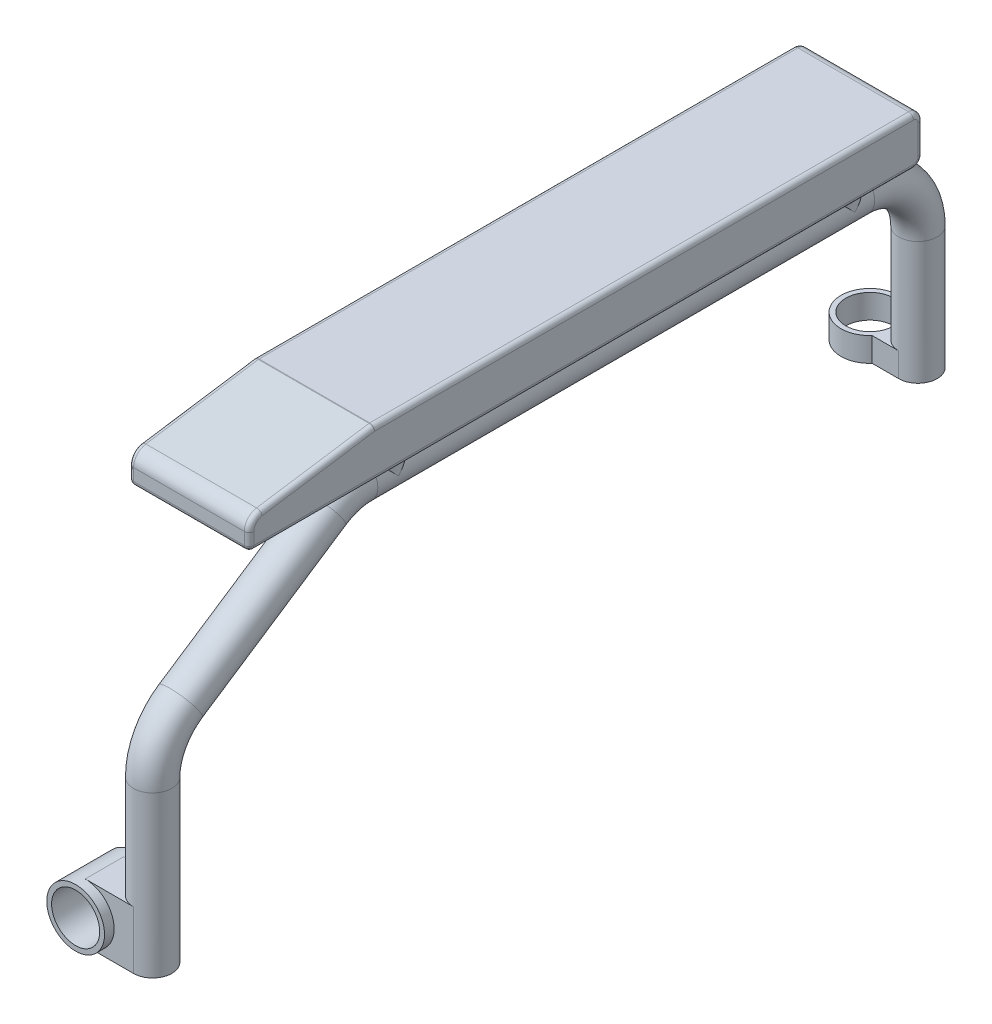
from build123d import *

# Parameters (mm, degrees)
SKETCH2_R                = 10.16
BOSS_EXTRUDE1_DEPTH      = 15.24
BOSS_EXTRUDE1_DEPTH_BACK = 15.24
SKETCH4_R                = 15.24
SKETCH5_R                = 10.16
BOSS_EXTRUDE2_DEPTH      = 15.24
SKETCH6_W                = 20.32
SKETCH6_H                = 30.48
BOSS_EXTRUDE3_DEPTH      = 25.4
SKETCH7_R                = 12.7
CUT_EXTRUDE1_DEPTH       = 461.805285208
SKETCH8_R                = 15.24
BOSS_EXTRUDE4_DEPTH      = 12.7
SKETCH10_W               = 20.32
SKETCH10_H               = 12.7
BOSS_EXTRUDE5_DEPTH      = 25.4
SKETCH11_R               = 12.7
CUT_EXTRUDE2_DEPTH       = 25.4
SKETCH12_R               = 10.16
BOSS_EXTRUDE6_DEPTH      = 25.4
BOSS_EXTRUDE7_DEPTH      = 31.75
BOSS_EXTRUDE7_DEPTH_BACK = 31.75
FILLET1_R                = 2.54
FILLET2_R                = 2.54


with BuildPart() as part:
    # Sweep1: sweep along a path in Sketch1
    with BuildLine(Plane(origin=(0, 0, 0), x_dir=(0, 0, -1), z_dir=(1, 0, 0))) as sweep1_path:
        Line((0, 0), (0, 69.32621332))
        ThreePointArc((0, 69.32621332), (3.933588394, 84.956346393), (14.797156867, 96.862523678))
        Line((14.797156867, 96.862523678), (90.432807933, 146.916310358))
        ThreePointArc((90.432807933, 146.916310358), (99.140625265, 150.999371974), (108.655651066, 152.4))
        Line((108.655651066, 152.4), (370.83999995, 152.4))
        ThreePointArc((370.83999995, 152.4), (394.188665865, 142.728665915), (403.85999995, 119.38))
        Line((403.85999995, 119.38), (403.85999995, 54.61))
    # Sketch2 → Sweep1 (sweep)
    with BuildSketch(Plane(origin=(0, 0, 0), x_dir=(1, 0, 0), z_dir=(0, 1, 0))):
        Circle(SKETCH2_R)
    sweep(path=sweep1_path.line)

    # Sketch5 → Boss-Extrude2 (add)
    with BuildSketch(Plane.XZ):
        with Locations(Location((0, 0, 0), (0, 0, 270))):
            Circle(SKETCH5_R)
    extrude(amount=BOSS_EXTRUDE2_DEPTH)



with BuildPart() as body_2:
    # Sketch4 → Boss-Extrude1 (new, two sides: drawn at the far end of the back side and taken through both)
    with BuildSketch(Plane.XY.offset(-BOSS_EXTRUDE1_DEPTH_BACK)):
        with Locations((-25.4, 0)):
            Circle(SKETCH4_R)
    extrude(amount=BOSS_EXTRUDE1_DEPTH + BOSS_EXTRUDE1_DEPTH_BACK)


with BuildPart() as part_1:
    add(part.part)

    add(body_2.part)  # Boss-Extrude3 merges body 2
    # Sketch6 → Boss-Extrude3 (add)
    with BuildSketch(Plane(origin=(0, 0, 0), x_dir=(0, 0, -1), z_dir=(1, 0, 0))):
        Rectangle(SKETCH6_W, SKETCH6_H)
    extrude(amount=-BOSS_EXTRUDE3_DEPTH)

    # Sketch7 → Cut-Extrude1 (cut, through all)
    with BuildSketch(Plane.XY.offset(15.24)):
        with Locations((-25.4, 0)):
            Circle(SKETCH7_R)
    extrude(amount=-CUT_EXTRUDE1_DEPTH, mode=Mode.SUBTRACT)



with BuildPart() as body_2_2:
    # Sketch8 → Boss-Extrude4 (new body)
    with BuildSketch(Plane(origin=(0, 54.61, 0), x_dir=(1, 0, 0), z_dir=(0, 1, 0))):
        with Locations(Location((-25.4, 403.85999995, 0), (0, 0, 270))):
            Circle(SKETCH8_R)
    extrude(amount=BOSS_EXTRUDE4_DEPTH)


with BuildPart() as part_2:
    add(part_1.part)

    add(body_2_2.part)  # Boss-Extrude5 merges body 2 2
    # Sketch10 → Boss-Extrude5 (add)
    with BuildSketch(Plane(origin=(0, 0, 0), x_dir=(0, 0, -1), z_dir=(1, 0, 0))):
        with Locations((403.85999995, 60.96)):
            Rectangle(SKETCH10_W, SKETCH10_H)
    extrude(amount=-BOSS_EXTRUDE5_DEPTH)

    # Sketch11 → Cut-Extrude2 (cut)
    with BuildSketch(Plane(origin=(0, 67.31, 0), x_dir=(1, 0, 0), z_dir=(0, 1, 0))):
        with Locations(Location((-25.4, 403.85999995, 0), (0, 0, 270))):
            Circle(SKETCH11_R)
    extrude(amount=-CUT_EXTRUDE2_DEPTH, mode=Mode.SUBTRACT)

    # Sketch12 → Boss-Extrude6 (add)
    with BuildSketch(Plane(origin=(0, 152.4, 0), x_dir=(1, 0, 0), z_dir=(0, 1, 0))):
        with Locations(Location((0, 360.410118202, 0), (0, 0, 270))):
            Circle(SKETCH12_R)
        with Locations(Location((0, 119.55398348, 0), (0, 0, 270))):
            Circle(SKETCH12_R)
    extrude(amount=BOSS_EXTRUDE6_DEPTH)

    # Sketch13 → Boss-Extrude7 (add, two sides: drawn at the far end of the back side and taken through both)
    with BuildSketch(Plane(origin=(0, 0, 0), x_dir=(0, 0, -1), z_dir=(1, 0, 0)).offset(-BOSS_EXTRUDE7_DEPTH_BACK)):
        with BuildLine():
            Line((369.685709653, 177.8), (21.679996961, 177.8))
            ThreePointArc((21.679996961, 177.8), (19.883945737, 178.543948776), (19.139996961, 180.34))
            Line((19.139996961, 180.34), (19.139996961, 186.682610789))
            ThreePointArc((19.139996961, 186.682610789), (20.983953383, 191.652693342), (25.623388191, 194.217364966))
            Line((25.623388191, 194.217364966), (85.170656017, 203.2))
            Line((85.170656017, 203.2), (369.685709653, 203.2))
            ThreePointArc((369.685709653, 203.2), (373.277812101, 201.712102448), (374.765709653, 198.12))
            Line((374.765709653, 198.12), (374.765709653, 182.88))
            ThreePointArc((374.765709653, 182.88), (373.277812101, 179.287897552), (369.685709653, 177.8))
        make_face()
    extrude(amount=BOSS_EXTRUDE7_DEPTH + BOSS_EXTRUDE7_DEPTH_BACK)

    # Fillet1
    fillet1_edges = [part_2.edges().sort_by_distance(p)[0] for p in [
        (-31.75, 177.8, -195.682853307),
        (-31.75, 198.708682483, -55.397022104),
        (-31.75, 203.2, -227.428182835),
        (-31.75, 201.712102448, -373.277812101),
        (-31.75, 190.5, -374.765709653),
        (-31.75, 179.287897552, -373.277812101),
        (-31.75, 178.543948776, -19.883945737),
        (-31.75, 183.511305395, -19.139996961),
        (-31.75, 191.652693342, -20.983953383),
        (31.75, 198.708682483, -55.397022104),
        (31.75, 191.652693342, -20.983953383),
        (31.75, 183.511305395, -19.139996961),
        (31.75, 178.543948776, -19.883945737),
        (31.75, 177.8, -195.682853307),
        (31.75, 179.287897552, -373.277812101),
        (31.75, 190.5, -374.765709653),
        (31.75, 201.712102448, -373.277812101),
        (31.75, 203.2, -227.428182835),
    ]]
    fillet(fillet1_edges, radius=FILLET1_R)

    # Fillet2
    fillet2_edges = [part_2.edges().sort_by_distance(p)[0] for p in [
        (0, 203.2, -85.170656017),
        (-31.007309319, 202.454792247, -85.226546707),
        (31.007309319, 202.454792247, -85.226546707),
    ]]
    fillet(fillet2_edges, radius=FILLET2_R)


solid = part_2.part
